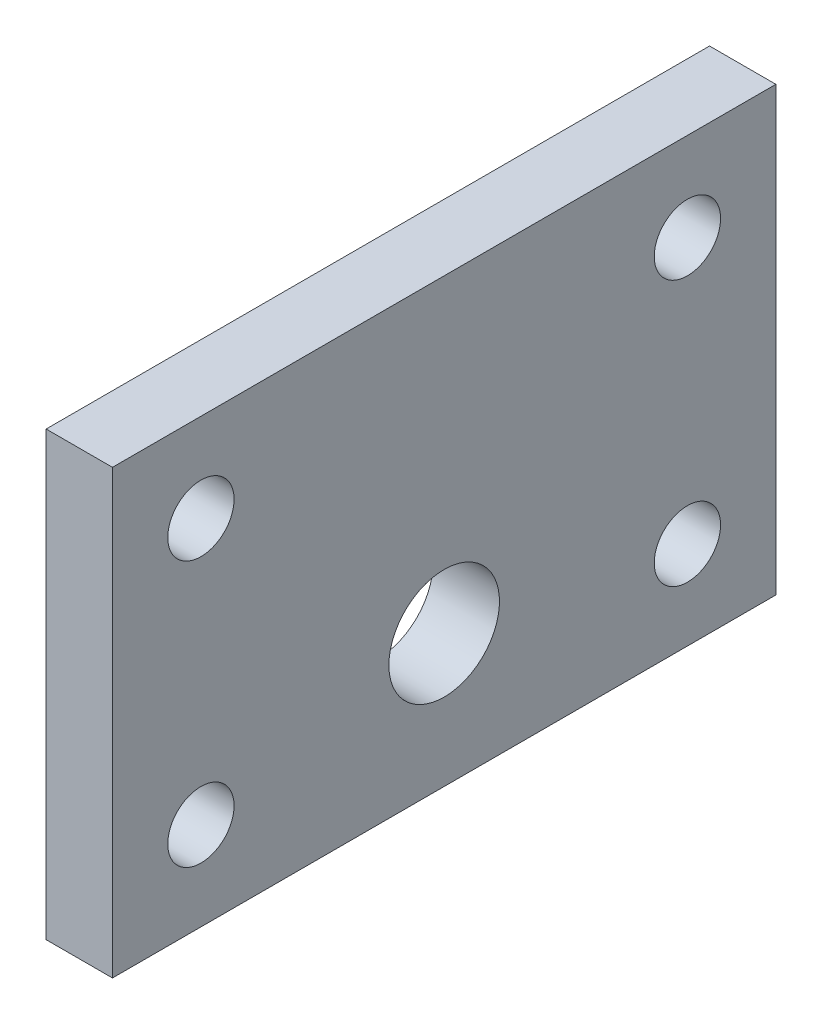
from build123d import *

# Parameters (mm, degrees)
SKETCH_1_W          = 30
SKETCH_1_H          = 20
SKETCH_1_R          = 1.5
EXTRUDE_1_DEPTH     = 3
CUT_EXTRUDE_1_REACH = 20.276
SKETCH_2_R          = 2.5


with BuildPart() as part:
    # 草图1 → 凸台-拉伸1 (new body)
    with BuildSketch(Plane(origin=(0, 0, 0), x_dir=(0, 0, -1), z_dir=(1, 0, 0))):
        Rectangle(SKETCH_1_W, SKETCH_1_H)
        with Locations((-11, 6)):
            Circle(SKETCH_1_R, mode=Mode.SUBTRACT)
        with Locations((-11, -6)):
            Circle(SKETCH_1_R, mode=Mode.SUBTRACT)
        with Locations(Location((11, -6, 0), (0, 0, 180))):
            Circle(SKETCH_1_R, mode=Mode.SUBTRACT)
        with Locations(Location((11, 6, 0), (0, 0, 180))):
            Circle(SKETCH_1_R, mode=Mode.SUBTRACT)
    extrude(amount=EXTRUDE_1_DEPTH)

    # 草图2 → 切除-拉伸1 (cut, up to next)
    with BuildSketch(Plane.ZY, mode=Mode.PRIVATE) as cut_extrude_1_sk1:
        with Locations((0, -4)):
            Circle(SKETCH_2_R)
    cut_extrude_1_tool1 = extrude(cut_extrude_1_sk1.sketch, amount=-CUT_EXTRUDE_1_REACH, mode=Mode.PRIVATE) & part.part
    add(cut_extrude_1_tool1.solids().sort_by_distance((0, -4, 0))[0], mode=Mode.SUBTRACT)


solid = part.part
